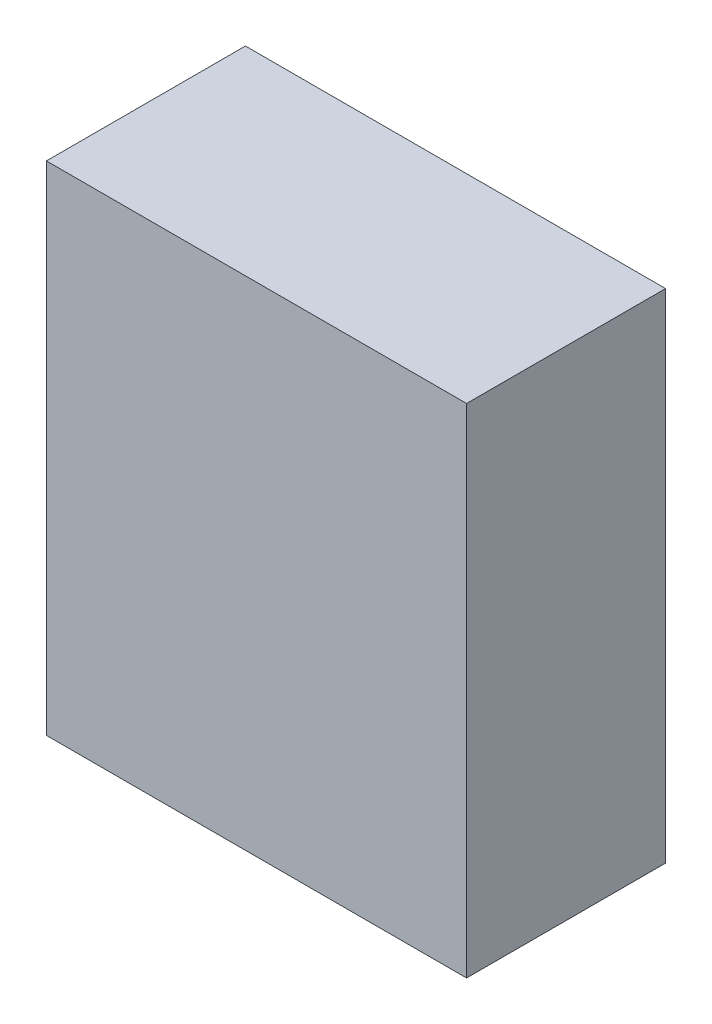
from build123d import *

# Parameters (mm, degrees)
SKETCH1_W      = 965.2
SKETCH1_H      = 457.2
EXTRUDE1_DEPTH = 1143


with BuildPart() as part:
    # Sketch1 → Extrude1 (new body)
    with BuildSketch(Plane(origin=(0, 0, 0), x_dir=(1, 0, 0), z_dir=(0, 1, 0))):
        with Locations((482.6, 228.6)):
            Rectangle(SKETCH1_W, SKETCH1_H)
    extrude(amount=EXTRUDE1_DEPTH)


solid = part.part
